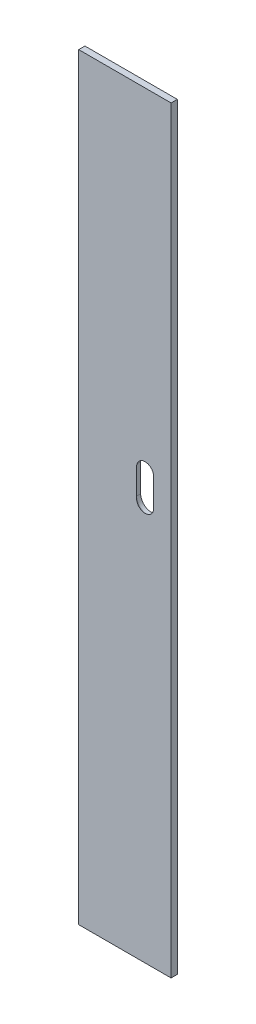
from build123d import *

# Parameters (mm, degrees)
SKETCH1_W           = 267
SKETCH1_H           = 2190
BOSS_EXTRUDE1_DEPTH = 18
CUT_EXTRUDE2_DEPTH  = 2185.317378496


with BuildPart() as part:
    # Sketch1 → Boss-Extrude1 (new body)
    with BuildSketch(Plane.XY):
        with Locations((-96.5, 1077.1)):
            Rectangle(SKETCH1_W, SKETCH1_H)
    extrude(amount=BOSS_EXTRUDE1_DEPTH)

    # Sketch2 → Cut-Extrude2 (cut, through all)
    with BuildSketch(Plane(origin=(0, 0, 0), x_dir=(-1, 0, 0), z_dir=(0, 0, -1))):
        with BuildLine():
            Line((58, 1212.1), (58, 1132.1))
            ThreePointArc((58, 1132.1), (38, 1112.1), (18, 1132.1))
            Line((18, 1132.1), (18, 1212.1))
            ThreePointArc((18, 1212.1), (38, 1232.1), (58, 1212.1))
        make_face()
    extrude(amount=-CUT_EXTRUDE2_DEPTH, mode=Mode.SUBTRACT)

    # Cut-Sweep4: sweep along a path in Sketch6
    with BuildLine(Plane.XY.offset(18)) as cut_sweep4_path:
        Line((-58, 1212.1), (-58, 1132.1))
        ThreePointArc((-58, 1132.1), (-38, 1112.1), (-18, 1132.1))
        Line((-18, 1132.1), (-18, 1212.1))
        ThreePointArc((-18, 1212.1), (-38, 1232.1), (-58, 1212.1))
    # Sketch5 → Cut-Sweep4 (sweep, cut)
    with BuildSketch(Plane(origin=(0, 1212.1, 0), x_dir=(0, 0, -1), z_dir=(0, -1, 0))):
        with BuildLine():
            Line((0, -62.6), (0, -68.9))
            Line((0, -68.9), (-11.7, -68.9))
            ThreePointArc((-11.7, -68.9), (-16.154772721, -67.054772721), (-18, -62.6))
            Line((-18, -62.6), (-18, -58))
            Line((-18, -58), (0, -58))
            Line((0, -58), (0, -62.6))
        make_face()
    sweep(path=cut_sweep4_path.line, mode=Mode.SUBTRACT)


solid = part.part
